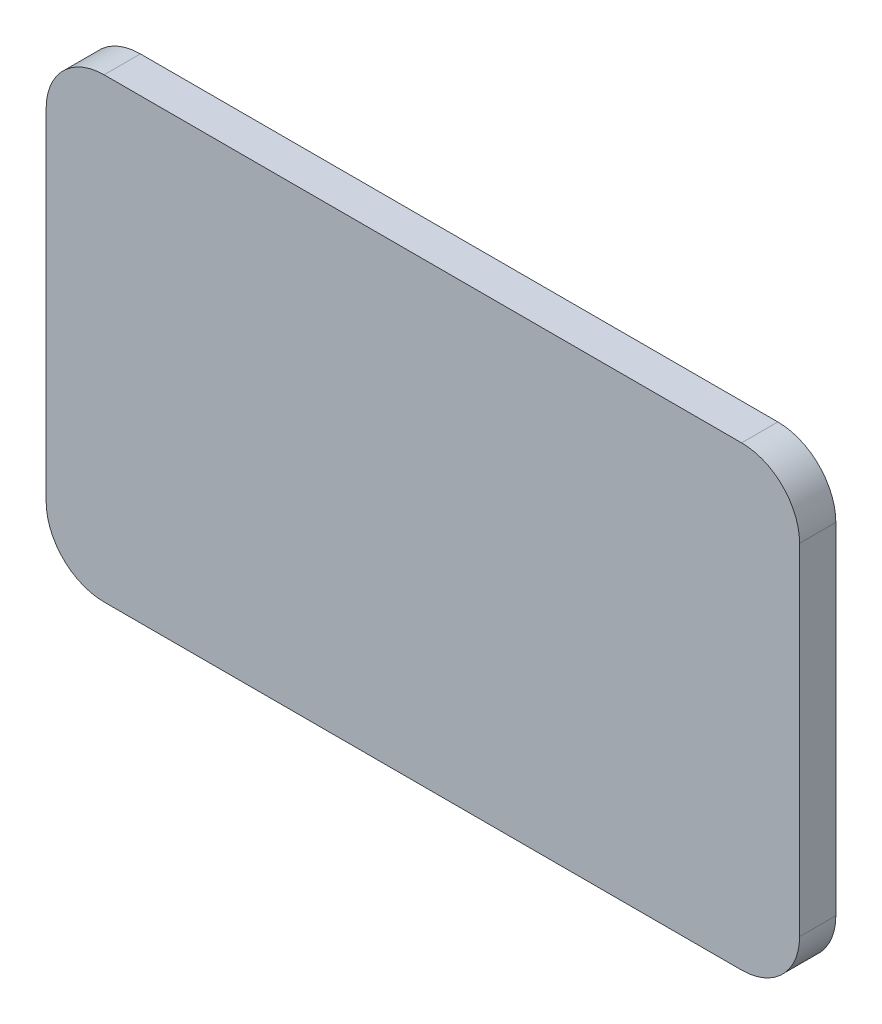
from build123d import *

# Parameters (mm, degrees)
BOSS_EXTRUDE1_DEPTH = 1.5875


with BuildPart() as part:
    # Sketch1 → Boss-Extrude1 (new body)
    with BuildSketch(Plane.XY):
        with BuildLine():
            Line((13.96, -10), (-13.96, -10))
            ThreePointArc((-13.96, -10), (-15.756051224, -9.256051224), (-16.5, -7.46))
            Line((-16.5, -7.46), (-16.5, 7.46))
            ThreePointArc((-16.5, 7.46), (-15.756051224, 9.256051224), (-13.96, 10))
            Line((-13.96, 10), (13.96, 10))
            ThreePointArc((13.96, 10), (15.756051224, 9.256051224), (16.5, 7.46))
            Line((16.5, 7.46), (16.5, -7.46))
            ThreePointArc((16.5, -7.46), (15.756051224, -9.256051224), (13.96, -10))
        make_face()
    extrude(amount=BOSS_EXTRUDE1_DEPTH)


solid = part.part
